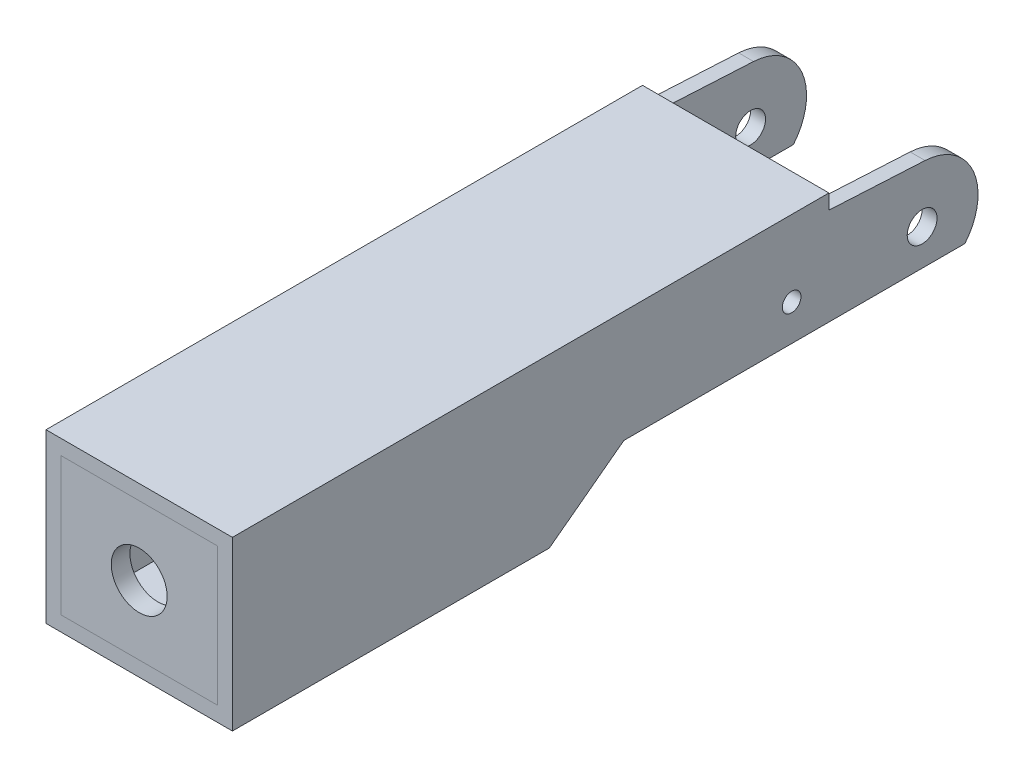
from build123d import *

# Parameters (mm, degrees)
SKETCH_1_W           = 50
SKETCH_1_H           = 45
SKETCH_1_W_2         = 42
SKETCH_1_H_2         = 37
EXTRUDE_1_DEPTH      = 200
SKETCH_2_OUTSIDE_W   = 244.202
SKETCH_2_OUTSIDE_H   = 89.202
SKETCH_2_OUTSIDE_R   = 2.5
SKETCH_2_OUTSIDE_R_2 = 4
CUT_EXTRUDE_1_DEPTH  = 212.00947846
SKETCH_3_W           = 42
SKETCH_3_H           = 37
SKETCH_3_R           = 7.5
EXTRUDE_2_DEPTH      = 5


with BuildPart() as part:
    # ｽｹｯﾁ1 → ﾎﾞｽ - 押し出し1 (new body)
    with BuildSketch(Plane.XY):
        with Locations((25, -22.5)):
            Rectangle(SKETCH_1_W, SKETCH_1_H)
        with Locations((25, -22.5)):
            Rectangle(SKETCH_1_W_2, SKETCH_1_H_2, mode=Mode.SUBTRACT)
    extrude(amount=EXTRUDE_1_DEPTH)

    # ｽｹｯﾁ2 outside → ｶｯﾄ - 押し出し1 (cut, through all)
    # profile 1 of 3: a face of its own
    with BuildSketch(Plane(origin=(50, 0, 0), x_dir=(0, 0, -1), z_dir=(1, 0, 0))):
        with Locations((-100, -22.5)):
            Rectangle(SKETCH_2_OUTSIDE_W, SKETCH_2_OUTSIDE_H)
        with BuildLine():
            Line((-3.522962143, -30), (-95, -30))
            Line((-95, -30), (-115, -45))
            Line((-115, -45), (-200, -45))
            Line((-200, -45), (-200, 0))
            Line((-200, 0), (-40, 0))
            Line((-40, 0), (-40, -4))
            Line((-40, -4), (-14.208480396, -5.362864969))
            ThreePointArc((-14.208480396, -5.362864969), (-1.238587239, -14.373422856), (-3.522962143, -30))
        make_face(mode=Mode.SUBTRACT)
    # profile 2 of 3: a face of its own
    with BuildSketch(Plane(origin=(50, 0, 0), x_dir=(0, 0, -1), z_dir=(1, 0, 0))):
        with Locations(Location((-50, -20.341966968, 0), (0, 0, 90))):
            Circle(SKETCH_2_OUTSIDE_R)
    # profile 3 of 3: a face of its own
    with BuildSketch(Plane(origin=(50, 0, 0), x_dir=(0, 0, -1), z_dir=(1, 0, 0))):
        with Locations(Location((-15, -20.341966968, 0), (0, 0, 90))):
            Circle(SKETCH_2_OUTSIDE_R_2)
    extrude(amount=-CUT_EXTRUDE_1_DEPTH, mode=Mode.SUBTRACT)


with BuildPart() as body_2:
    # ｽｹｯﾁ3 → ﾎﾞｽ - 押し出し2 (new body)
    with BuildSketch(Plane.XY.offset(200)):
        with Locations((25, -22.5)):
            Rectangle(SKETCH_3_W, SKETCH_3_H)
        with Locations((25, -22.5)):
            Circle(SKETCH_3_R, mode=Mode.SUBTRACT)
    extrude(amount=-EXTRUDE_2_DEPTH)


solid = Compound([part.part, body_2.part])
